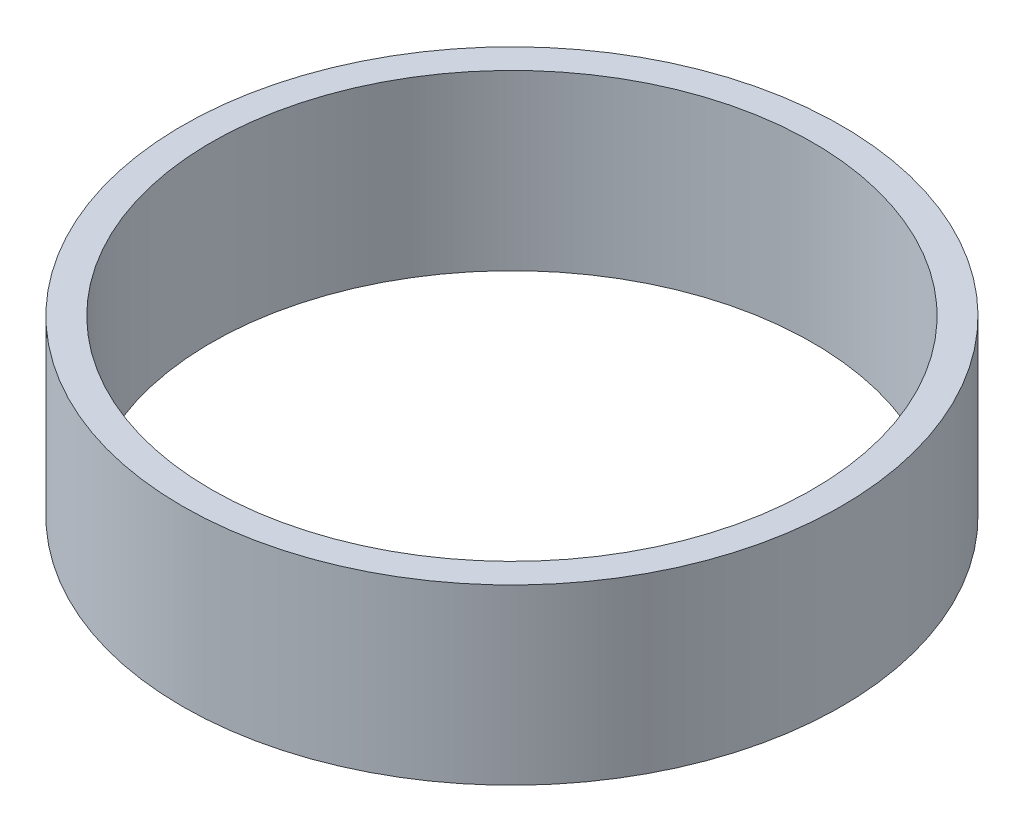
from build123d import *

# Parameters (mm, degrees)
SKETCH_1_R      = 57
SKETCH_1_R_2    = 52
EXTRUDE_1_DEPTH = 30


with BuildPart() as part:
    # 草图1 → 凸台-拉伸1 (new body)
    with BuildSketch(Plane(origin=(0, 0, 0), x_dir=(1, 0, 0), z_dir=(0, 1, 0))):
        with Locations(Location((0, 0, 0), (0, 0, 270))):
            Circle(SKETCH_1_R)
        with Locations(Location((0, 0, 0), (0, 0, 270))):
            Circle(SKETCH_1_R_2, mode=Mode.SUBTRACT)
    extrude(amount=EXTRUDE_1_DEPTH)


solid = part.part
